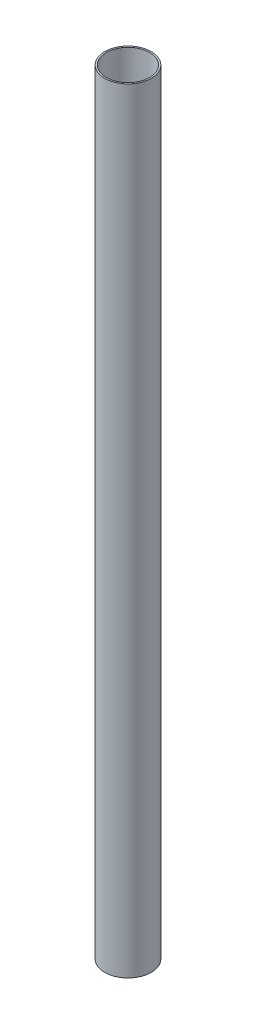
from build123d import *

# Parameters (mm, degrees)
SKETCH_1_R      = 3
SKETCH_1_R_2    = 2.8
EXTRUDE_1_DEPTH = 100


with BuildPart() as part:
    # 草图1 → 凸台-拉伸1 (new body)
    with BuildSketch(Plane(origin=(0, 0, 0), x_dir=(1, 0, 0), z_dir=(0, 1, 0))):
        with Locations(Location((0, 0, 0), (0, 0, 270))):
            Circle(SKETCH_1_R)
        with Locations(Location((0, 0, 0), (0, 0, 270))):
            Circle(SKETCH_1_R_2, mode=Mode.SUBTRACT)
    extrude(amount=EXTRUDE_1_DEPTH)


solid = part.part
